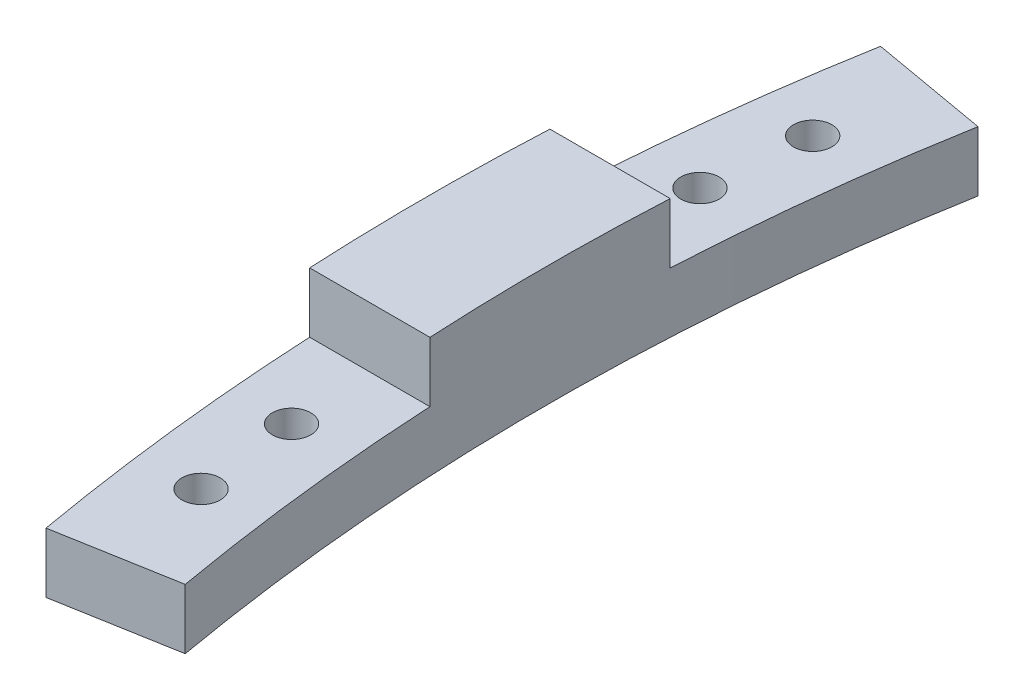
from build123d import *

# Parameters (mm, degrees)
BOSS_EXTRUDE1_DEPTH        = 5
BOSS_EXTRUDE2_DEPTH        = 5
F_3_2_3_2_DIAMETER_HOLE1_D = 3.2


with BuildPart() as part:
    # Sketch1 → Boss-Extrude1 (new body)
    with BuildSketch(Plane(origin=(0, 0, 0), x_dir=(1, 0, 0), z_dir=(0, 1, 0))):
        with BuildLine():
            Line((-196.961550602, 34.729635533), (-187.113473072, 32.993153757))
            ThreePointArc((-187.113473072, 32.993153757), (-190, 0), (-187.113473072, -32.993153757))
            Line((-187.113473072, -32.993153757), (-196.961550602, -34.729635533))
            ThreePointArc((-196.961550602, -34.729635533), (-200, 0), (-196.961550602, 34.729635533))
        make_face()
    extrude(amount=BOSS_EXTRUDE1_DEPTH)

    # Sketch9 → Boss-Extrude2 (add)
    with BuildSketch(Plane(origin=(0, 5, 0), x_dir=(1, 0, 0), z_dir=(0, 1, 0))):
        with BuildLine():
            Line((-199.749843554, 10), (-189.73665961, 10))
            ThreePointArc((-189.73665961, 10), (-190, 0), (-189.73665961, -10))
            Line((-189.73665961, -10), (-199.749843554, -10))
            ThreePointArc((-199.749843554, -10), (-200, 0), (-199.749843554, 10))
        make_face()
    extrude(amount=BOSS_EXTRUDE2_DEPTH)

    # Ø3.2 (3.2) Diameter Hole1 (through all)
    with Locations(Plane(origin=(0, 5, 0), x_dir=(1, 0, 0), z_dir=(0, 1, 0))):
        with Locations((-194.257966128, 16.995369836), (-193.331747968, 25.452607483), (-194.257966128, -16.995369836), (-193.331747968, -25.452607483)):
            Hole(F_3_2_3_2_DIAMETER_HOLE1_D / 2)


solid = part.part
